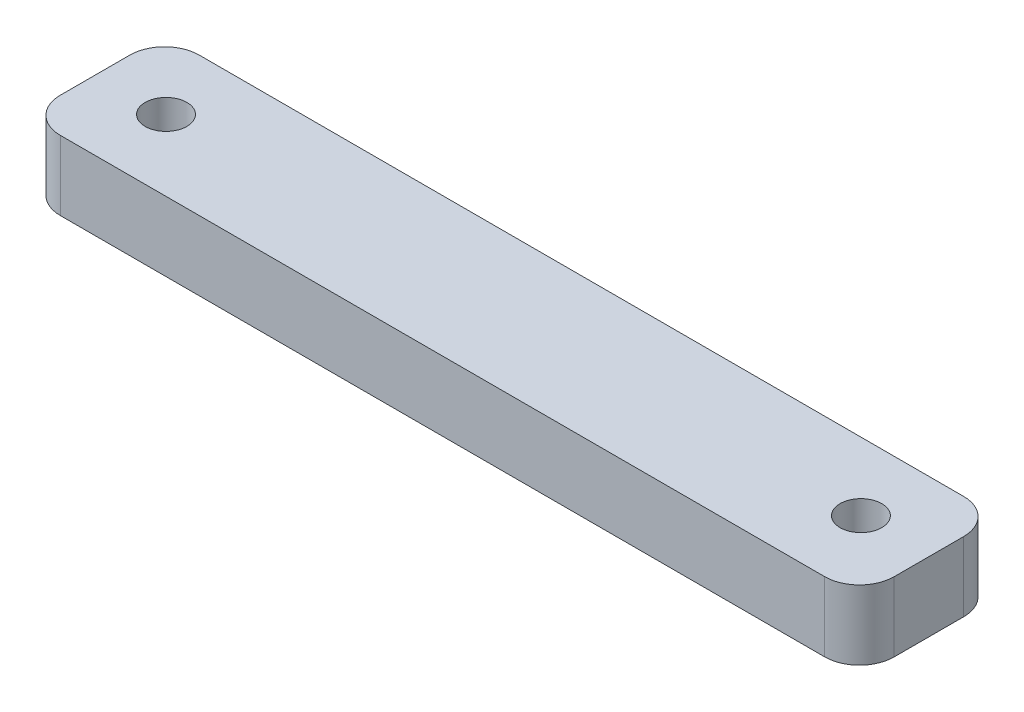
from build123d import *

# Parameters (mm, degrees)
SKETCH1_R           = 3.81
BOSS_EXTRUDE1_DEPTH = 12.7


with BuildPart() as part:
    # Sketch1 → Boss-Extrude1 (new body)
    with BuildSketch(Plane(origin=(0, 0, 0), x_dir=(1, 0, 0), z_dir=(0, 1, 0))):
        with BuildLine():
            Line((6.35, 0), (146.05, 0))
            ThreePointArc((146.05, 0), (150.540128061, 1.859871939), (152.4, 6.35))
            Line((152.4, 6.35), (152.4, 19.05))
            ThreePointArc((152.4, 19.05), (150.540128061, 23.540128061), (146.05, 25.4))
            Line((146.05, 25.4), (6.35, 25.4))
            ThreePointArc((6.35, 25.4), (1.859871939, 23.540128061), (0, 19.05))
            Line((0, 19.05), (0, 6.35))
            ThreePointArc((0, 6.35), (1.859871939, 1.859871939), (6.35, 0))
        make_face()
        with Locations(Location((12.7, 12.968763491, 0), (0, 0, 270))):
            Circle(SKETCH1_R, mode=Mode.SUBTRACT)
        with Locations(Location((139.7, 12.968763491, 0), (0, 0, 270))):
            Circle(SKETCH1_R, mode=Mode.SUBTRACT)
    extrude(amount=BOSS_EXTRUDE1_DEPTH)


solid = part.part
